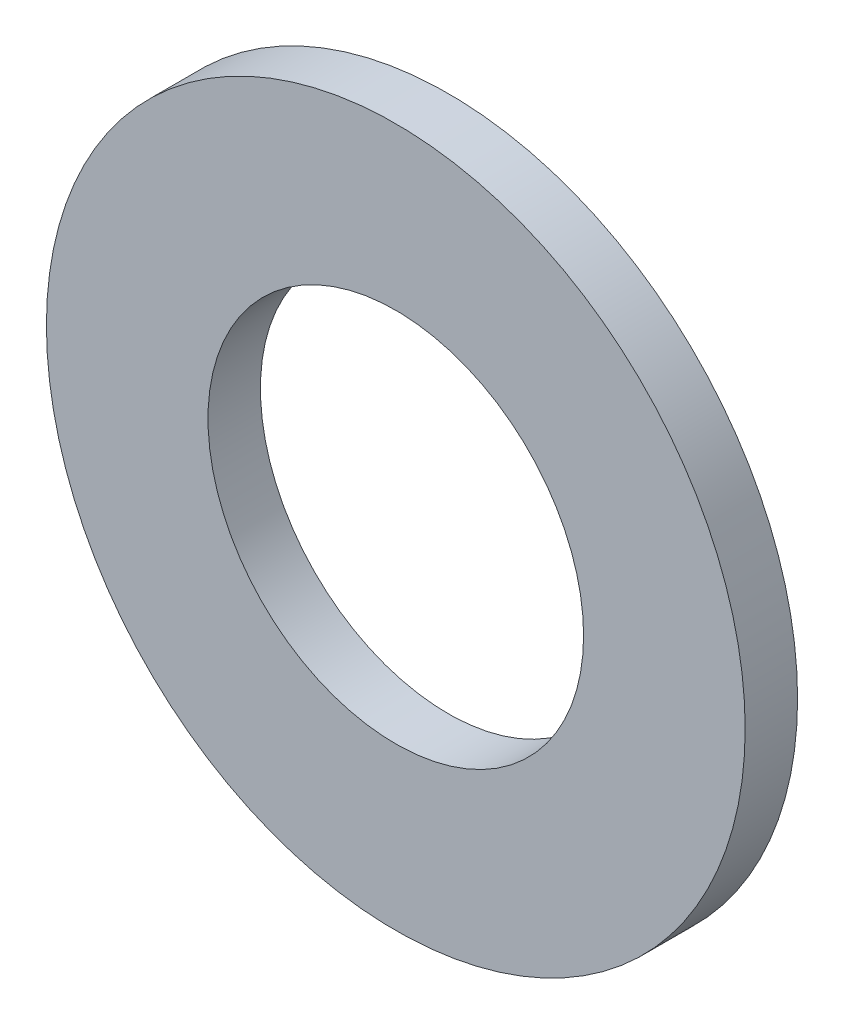
from build123d import *

# Parameters (mm, degrees)
BOSS_EXTRUDE1_DEPTH      = 0.3
BOSS_EXTRUDE1_DEPTH_BACK = 0.3
SKETCH3_R                = 4
SKETCH3_R_2              = 2.15


with BuildPart() as part:
    # Sketch3 → Boss-Extrude1 (new, two sides: drawn at the far end of the back side and taken through both)
    with BuildSketch(Plane.XY.offset(-BOSS_EXTRUDE1_DEPTH_BACK)):
        Circle(SKETCH3_R)
        Circle(SKETCH3_R_2, mode=Mode.SUBTRACT)
    extrude(amount=BOSS_EXTRUDE1_DEPTH + BOSS_EXTRUDE1_DEPTH_BACK)


solid = part.part
